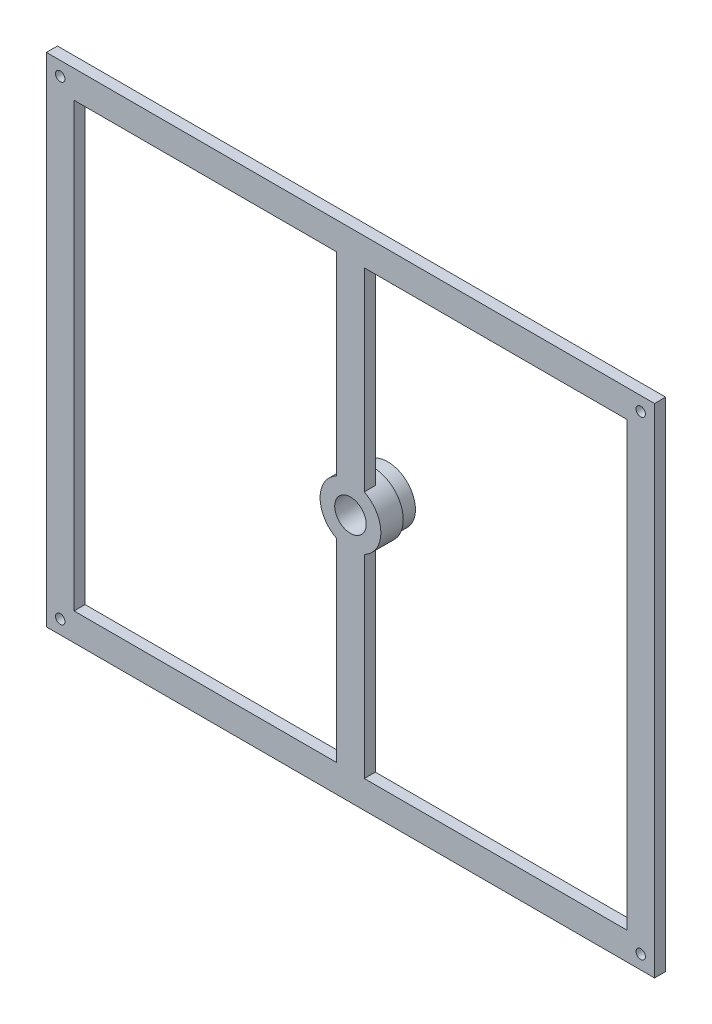
from build123d import *

# Parameters (mm, degrees)
UPPER_PERIMETER_START                         = 304
SKETCH1_W                                     = 220
SKETCH1_H                                     = 180
SKETCH1_W_2                                   = 200
SKETCH1_H_2                                   = 160
UPPER_PERIMETER_DEPTH                         = 4
BEARING_SPINE_START                           = 304
SKETCH2_W                                     = 10
SKETCH2_H                                     = 170
BEARING_SPINE_DEPTH                           = 4
UPPER_OUTER_RACE_STOP_START                   = 299.9
SKETCH3_R                                     = 11
SKETCH3_R_2                                   = 5.7
UPPER_OUTER_RACE_STOP_DEPTH                   = 8.1
FLOATING_OUTER_RACE_SEAT_START                = 294.5
SKETCH4_R                                     = 10
SKETCH4_R_2                                   = 6.5
FLOATING_OUTER_RACE_SEAT_DEPTH                = 5.41
SHAFT_CLIP_CLEARANCE_START                    = -8.11
SKETCH5_R                                     = 5.7
SHAFT_CLIP_CLEARANCE_DEPTH                    = 8.11
SKETCH6_R                                     = 1.7
FOUR_TIE_ROD_CLEARANCE_DEPTH                  = 4.01
SKETCH7_R                                     = 1
THREE_M2_TOP_CAP_THREAD_MAJOR_ENVELOPES_DEPTH = 4.3


with BuildPart() as part:
    # Sketch1 → Upper_Perimeter (new body)
    with BuildSketch(Plane.XY.offset(UPPER_PERIMETER_START)):
        Rectangle(SKETCH1_W, SKETCH1_H)
        Rectangle(SKETCH1_W_2, SKETCH1_H_2, mode=Mode.SUBTRACT)
    extrude(amount=UPPER_PERIMETER_DEPTH)

    # Sketch2 → Bearing_Spine (add)
    with BuildSketch(Plane.XY.offset(BEARING_SPINE_START)):
        Rectangle(SKETCH2_W, SKETCH2_H)
    extrude(amount=BEARING_SPINE_DEPTH)

    # Sketch3 → Upper_Outer_Race_Stop (add)
    with BuildSketch(Plane.XY.offset(UPPER_OUTER_RACE_STOP_START)):
        with Locations(Location((0, 0, 0), (0, 0, 117.035691789))):
            Circle(SKETCH3_R)
        with Locations(Location((0, 0, 0), (0, 0, 208.694413527))):
            Circle(SKETCH3_R_2, mode=Mode.SUBTRACT)
    extrude(amount=UPPER_OUTER_RACE_STOP_DEPTH)

    # Sketch4 → Floating_Outer_Race_Seat (add)
    with BuildSketch(Plane.XY.offset(FLOATING_OUTER_RACE_SEAT_START)):
        Circle(SKETCH4_R)
        Circle(SKETCH4_R_2, mode=Mode.SUBTRACT)
    extrude(amount=FLOATING_OUTER_RACE_SEAT_DEPTH)

    # Sketch5 → Shaft_Clip_Clearance (cut)
    with BuildSketch(Plane.XY.offset(308).offset(SHAFT_CLIP_CLEARANCE_START)):
        Circle(SKETCH5_R)
    extrude(amount=SHAFT_CLIP_CLEARANCE_DEPTH, mode=Mode.SUBTRACT)

    # Sketch6 → Four_Tie_Rod_Clearance (cut)
    with BuildSketch(Plane.XY.offset(308)):
        with Locations((-105, -85)):
            Circle(SKETCH6_R)
        with Locations((-105, 85)):
            Circle(SKETCH6_R)
        with Locations((105, -85)):
            Circle(SKETCH6_R)
        with Locations((105, 85)):
            Circle(SKETCH6_R)
    extrude(amount=-FOUR_TIE_ROD_CLEARANCE_DEPTH, mode=Mode.SUBTRACT)

    # Sketch7 → Three_M2_Top_Cap_Thread_Major_Envelopes (cut)
    with BuildSketch(Plane(origin=(0, 0, 294.5), x_dir=(-1, 0, 0), z_dir=(0, 0, -1))):
        with Locations((-7.188010851, 4.15)):
            Circle(SKETCH7_R)
        with Locations((7.188010851, 4.15)):
            Circle(SKETCH7_R)
        with Locations((0, -8.3)):
            Circle(SKETCH7_R)
    extrude(amount=-THREE_M2_TOP_CAP_THREAD_MAJOR_ENVELOPES_DEPTH, mode=Mode.SUBTRACT)


solid = part.part
